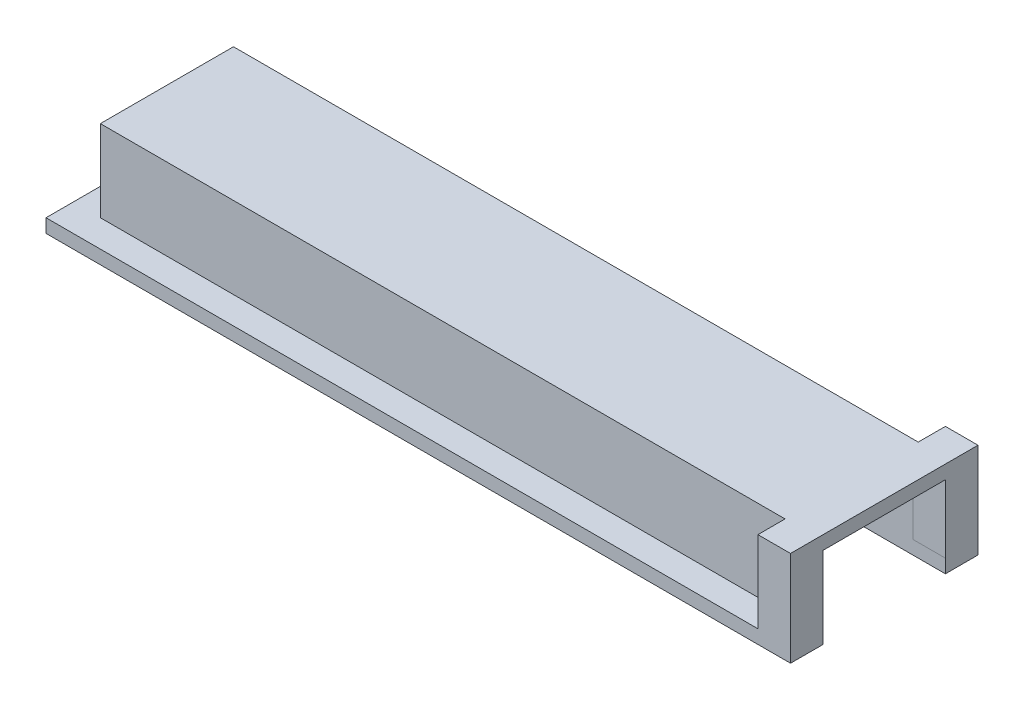
from build123d import *

# Parameters (mm, degrees)
BOSS_EXTRUDE1_DEPTH = 5
BOSS_EXTRUDE2_DEPTH = 30
SKETCH4_W           = 262
SKETCH4_H           = 45
BOSS_EXTRUDE3_DEPTH = 5


with BuildPart() as part:
    # Sketch1 → Boss-Extrude1 (new body)
    with BuildSketch(Plane(origin=(0, 0, 0), x_dir=(1, 0, 0), z_dir=(0, 1, 0))):
        Polygon((137, -22.5), (125, -22.5), (-125, -22.5), (-125, 22.5), (125, 22.5), (137, 22.5), (137, 34.5), (-137, 34.5), (-137, -34.5), (137, -34.5), align=None)
    extrude(amount=BOSS_EXTRUDE1_DEPTH)

    # Sketch2 → Boss-Extrude2 (add)
    with BuildSketch(Plane(origin=(0, 5, 0), x_dir=(1, 0, 0), z_dir=(0, 1, 0))):
        Polygon((125, 22.5), (125, 22.499356702), (137, 22.5), (137, 34.5), (125, 34.5), (125, 24.499356702), (-127, 24.499356702), (-127, -24.499356702), (125, -24.499356702), (125, -34.5), (137, -34.5), (137, -22.5), (125, -22.499356702), (125, -22.5), (-125, -22.5), (-125, 22.5), align=None)
    extrude(amount=BOSS_EXTRUDE2_DEPTH)

    # Sketch4 → Boss-Extrude3 (add)
    with BuildSketch(Plane(origin=(0, 35, 0), x_dir=(1, 0, 0), z_dir=(0, 1, 0))):
        with Locations((6, 0)):
            Rectangle(SKETCH4_W, SKETCH4_H)
    extrude(amount=-BOSS_EXTRUDE3_DEPTH)


solid = part.part
